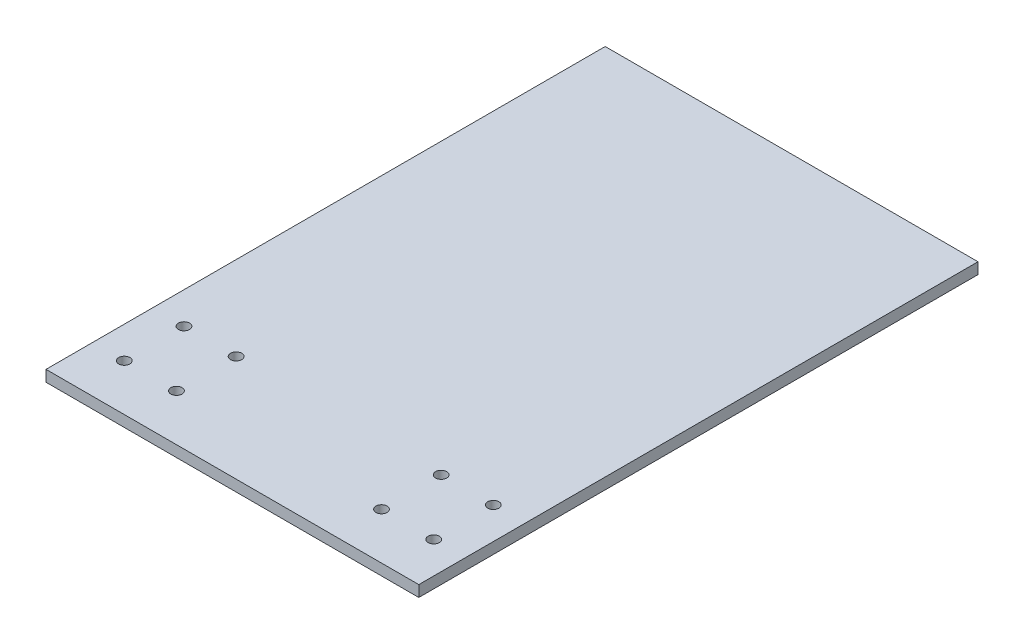
from build123d import *

# Parameters (mm, degrees)
SKETCH_1_W      = 100
SKETCH_1_H      = 150
SKETCH_1_R      = 1.5
EXTRUDE_1_DEPTH = 3


with BuildPart() as part:
    # 草图1 → 凸台-拉伸1 (new body)
    with BuildSketch(Plane(origin=(0, 0, 0), x_dir=(1, 0, 0), z_dir=(0, 1, 0))):
        Rectangle(SKETCH_1_W, SKETCH_1_H)
        with Locations(Location((-41.5, -62.5, 0), (0, 0, 270))):
            Circle(SKETCH_1_R, mode=Mode.SUBTRACT)
        with Locations(Location((-41.5, -46.5, 0), (0, 0, 90))):
            Circle(SKETCH_1_R, mode=Mode.SUBTRACT)
        with Locations(Location((-27.5, -62.5, 0), (0, 0, 90))):
            Circle(SKETCH_1_R, mode=Mode.SUBTRACT)
        with Locations(Location((-27.5, -46.5, 0), (0, 0, 270))):
            Circle(SKETCH_1_R, mode=Mode.SUBTRACT)
        with Locations(Location((41.5, -62.5, 0), (0, 0, 90))):
            Circle(SKETCH_1_R, mode=Mode.SUBTRACT)
        with Locations(Location((27.5, -62.5, 0), (0, 0, 270))):
            Circle(SKETCH_1_R, mode=Mode.SUBTRACT)
        with Locations(Location((27.5, -46.5, 0), (0, 0, 90))):
            Circle(SKETCH_1_R, mode=Mode.SUBTRACT)
        with Locations(Location((41.5, -46.5, 0), (0, 0, 270))):
            Circle(SKETCH_1_R, mode=Mode.SUBTRACT)
    extrude(amount=EXTRUDE_1_DEPTH)


solid = part.part
